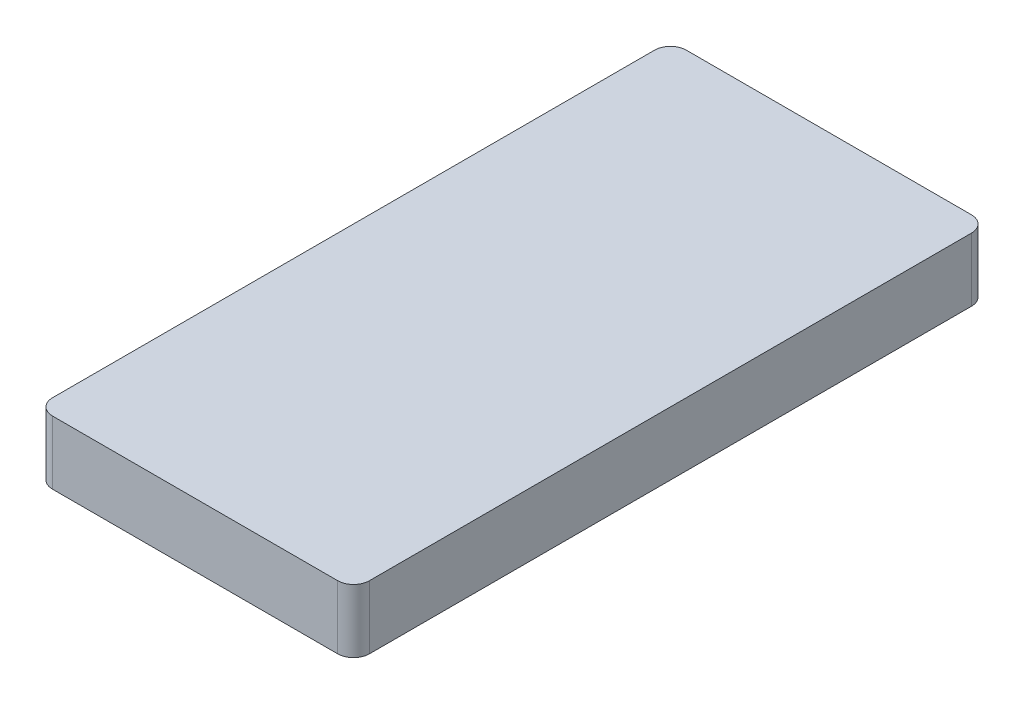
from build123d import *

# Parameters (mm, degrees)
SKETCH1_W           = 10
SKETCH1_H           = 20
BOSS_EXTRUDE1_DEPTH = 2
FILLET1_R           = 0.5


with BuildPart() as part:
    # Sketch1 → Boss-Extrude1 (new body)
    with BuildSketch(Plane(origin=(0, 0, 0), x_dir=(1, 0, 0), z_dir=(0, 1, 0))):
        Rectangle(SKETCH1_W, SKETCH1_H)
    extrude(amount=BOSS_EXTRUDE1_DEPTH)

    # Fillet1
    fillet1_edges = [part.edges().sort_by_distance(p)[0] for p in [
        (5, 1, 10),
        (-5, 1, 10),
        (-5, 1, -10),
        (5, 1, -10),
    ]]
    fillet(fillet1_edges, radius=FILLET1_R)


solid = part.part
